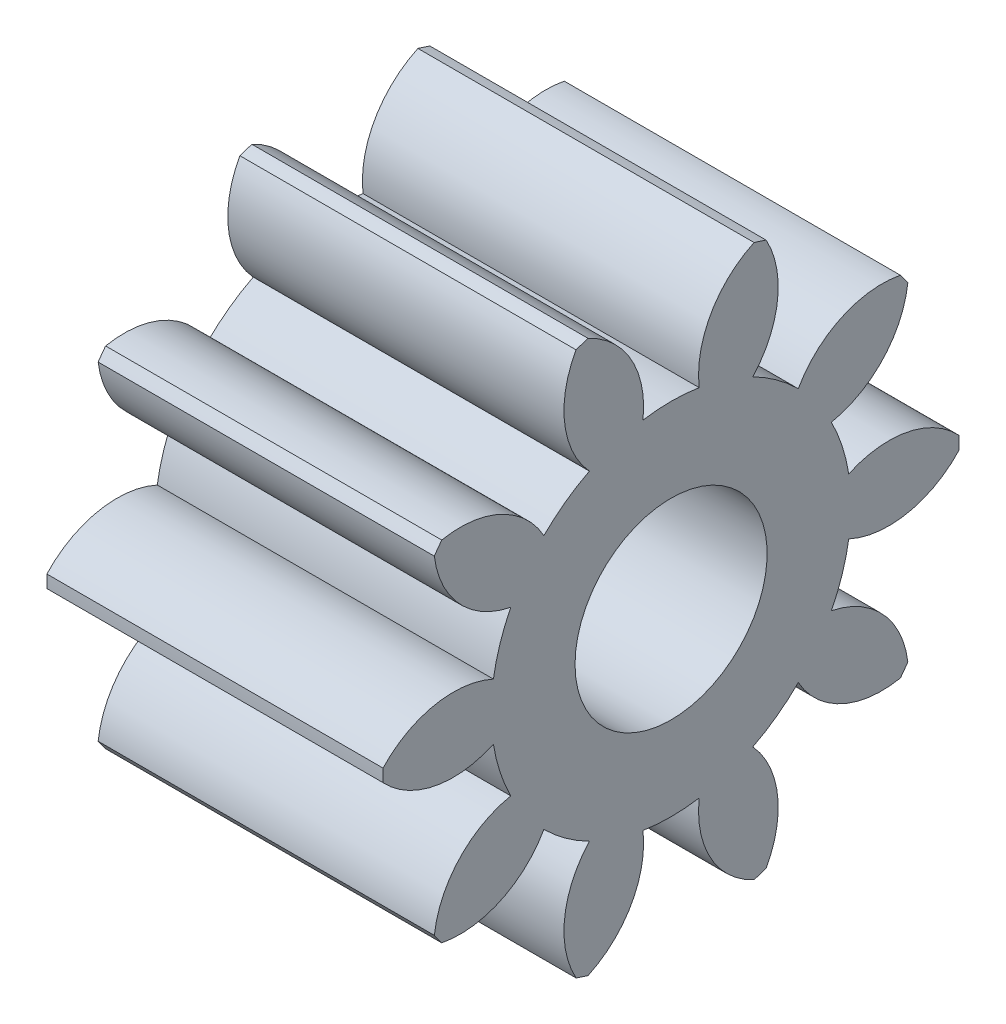
from build123d import *

# Parameters (mm, degrees)
BASPROSKE_W     = 1.75
BASPROSKE_H     = 1.5
TOOTHCUT_DEPTH  = 3.75
TEETHCUTS_COUNT = 10
TEETHCUTS_ANGLE = 324
BORSKE_R        = 0.5
BORE_DEPTH      = 50.0000508


with BuildPart() as part:
    # BasProSke → Base-Revolve (revolve)
    with BuildSketch(Plane(origin=(0, 0, 0), x_dir=(1, 0, 0), z_dir=(0, 1, 0)), mode=Mode.PRIVATE) as base_revolve_sk:
        with Locations((0.875, 0.75)):
            Rectangle(BASPROSKE_W, BASPROSKE_H)
    revolve(base_revolve_sk.sketch.rotate(Axis((-10, 0, 0), (1, 0, 0)), 180), axis=Axis((-10, 0, 0), (1, 0, 0)))

    # TooCutSke → ToothCut (cut, through all)
    with BuildSketch(Plane(origin=(0, 0, 0), x_dir=(0, 0, -1), z_dir=(1, 0, 0))):
        with BuildLine():
            ThreePointArc((0.146321185, 0.924998573), (0, 0.9365), (-0.146321185, 0.924998573))
            ThreePointArc((-0.146321185, 0.924998573), (-0.216454601, 1.244005636), (-0.468585949, 1.451644712))
            ThreePointArc((-0.468585949, 1.451644712), (0, 1.5254), (0.468585949, 1.451644712))
            ThreePointArc((0.468585949, 1.451644712), (0.216454601, 1.244005636), (0.146321185, 0.924998573))
        make_face()
    toothcut = extrude(amount=TOOTHCUT_DEPTH, mode=Mode.SUBTRACT)

    # TeethCuts: ToothCut ×10 about axis
    teethcuts_axis = Axis((-10, 0, 0), (1, 0, 0))
    for i in range(1, TEETHCUTS_COUNT):
        add(toothcut.rotate(teethcuts_axis, i * TEETHCUTS_ANGLE / (TEETHCUTS_COUNT - 1)), mode=Mode.SUBTRACT)

    # BorSke → Bore (cut, symmetric)
    with BuildSketch(Plane(origin=(0, 0, 0), x_dir=(0, 0, -1), z_dir=(1, 0, 0))):
        with Locations(Location((0, 0, 0), (0, 0, 180))):
            Circle(BORSKE_R)
    extrude(amount=BORE_DEPTH, both=True, mode=Mode.SUBTRACT)


solid = part.part
